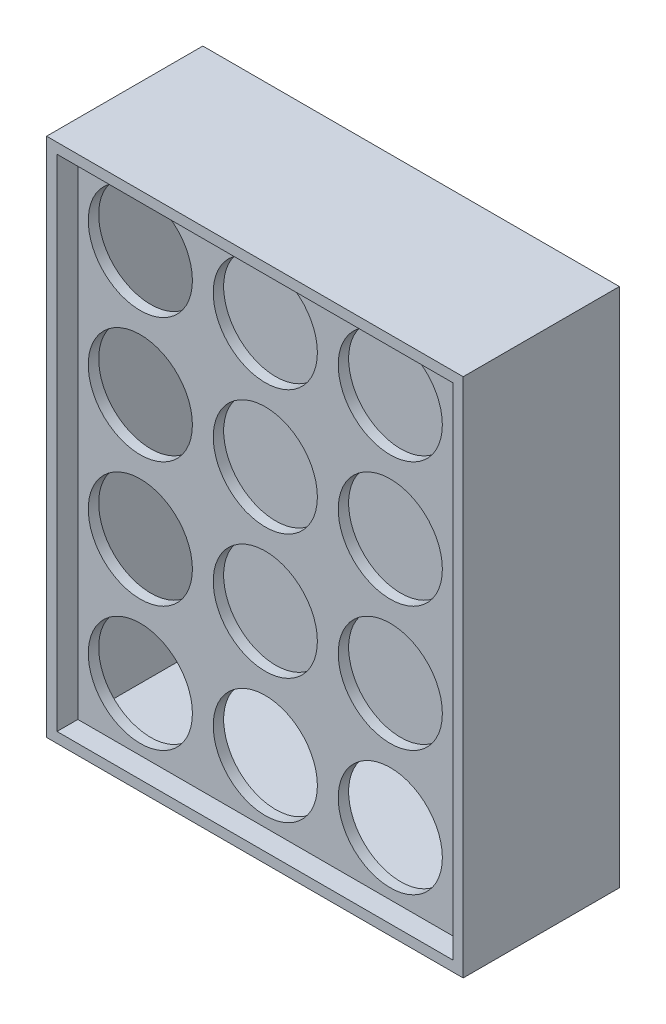
from build123d import *

# Parameters (mm, degrees)
SKETCH1_W           = 200
SKETCH1_H           = 250
BOSS_EXTRUDE1_DEPTH = 5
SKETCH2_W           = 200
SKETCH2_H           = 250
SKETCH2_W_2         = 190
SKETCH2_H_2         = 240
BOSS_EXTRUDE2_DEPTH = 70
BOSS_EXTRUDE3_START = -15
SKETCH3_W           = 190
SKETCH3_H           = 240
BOSS_EXTRUDE3_DEPTH = 5
SKETCH4_R           = 25
CUT_EXTRUDE1_DEPTH  = 5


with BuildPart() as part:
    # Sketch1 → Boss-Extrude1 (new body)
    with BuildSketch(Plane.XY):
        with Locations((100, -125)):
            Rectangle(SKETCH1_W, SKETCH1_H)
    extrude(amount=BOSS_EXTRUDE1_DEPTH)

    # Sketch2 → Boss-Extrude2 (add)
    with BuildSketch(Plane.XY.offset(5)):
        with Locations((100, -125)):
            Rectangle(SKETCH2_W, SKETCH2_H)
        with Locations((100, -125)):
            Rectangle(SKETCH2_W_2, SKETCH2_H_2, mode=Mode.SUBTRACT)
    extrude(amount=BOSS_EXTRUDE2_DEPTH)

    # Sketch3 → Boss-Extrude3 (add)
    with BuildSketch(Plane.XY.offset(75).offset(BOSS_EXTRUDE3_START)):
        with Locations((100, -125)):
            Rectangle(SKETCH3_W, SKETCH3_H)
    extrude(amount=BOSS_EXTRUDE3_DEPTH)

    # Sketch4 → Cut-Extrude1 (cut)
    with BuildSketch(Plane.XY.offset(65)):
        with Locations((35, -35)):
            Circle(SKETCH4_R)
        with Locations((95, -35)):
            Circle(SKETCH4_R)
        with Locations((155, -35)):
            Circle(SKETCH4_R)
        with Locations((95, -95)):
            Circle(SKETCH4_R)
        with Locations((155, -95)):
            Circle(SKETCH4_R)
        with Locations((95, -155)):
            Circle(SKETCH4_R)
        with Locations((155, -155)):
            Circle(SKETCH4_R)
        with Locations((95, -215)):
            Circle(SKETCH4_R)
        with Locations((155, -215)):
            Circle(SKETCH4_R)
        with Locations((35, -95)):
            Circle(SKETCH4_R)
        with Locations((35, -155)):
            Circle(SKETCH4_R)
        with Locations((35, -215)):
            Circle(SKETCH4_R)
    extrude(amount=-CUT_EXTRUDE1_DEPTH, mode=Mode.SUBTRACT)


solid = part.part
